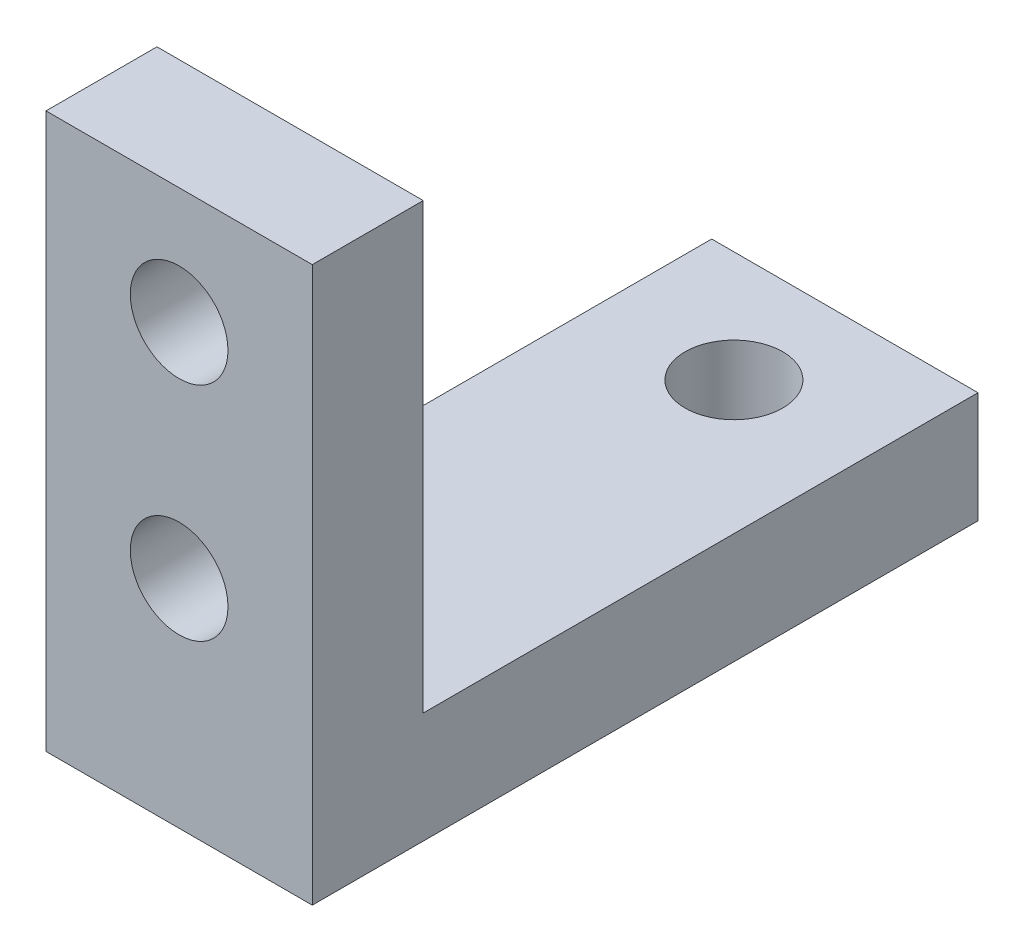
from build123d import *

# Parameters (mm, degrees)
SKETCH1_W           = 5
SKETCH1_H           = 20
SKETCH1_H_2         = 5
SKETCH1_W_2         = 25
BOSS_EXTRUDE1_DEPTH = 12
SKETCH2_R           = 2.2
CUT_EXTRUDE1_DEPTH  = 12
CUT_EXTRUDE3_DEPTH  = 5


with BuildPart() as part:
    # Sketch1 → Boss-Extrude1 (new body)
    with BuildSketch(Plane(origin=(0, 0, 0), x_dir=(0, 0, -1), z_dir=(1, 0, 0))):
        with Locations((2.5, 15)):
            Rectangle(SKETCH1_W, SKETCH1_H)
        with Locations((2.5, 2.5)):
            Rectangle(SKETCH1_W, SKETCH1_H_2)
        with Locations((17.5, 2.5)):
            Rectangle(SKETCH1_W_2, SKETCH1_H_2)
    extrude(amount=BOSS_EXTRUDE1_DEPTH)

    # Sketch2 → Cut-Extrude1 (cut)
    with BuildSketch(Plane(origin=(0, 0, -5), x_dir=(-1, 0, 0), z_dir=(0, 0, -1))):
        with Locations((-6, 19.75)):
            Circle(SKETCH2_R)
        with Locations((-6, 9.75)):
            Circle(SKETCH2_R)
    extrude(amount=-CUT_EXTRUDE1_DEPTH, mode=Mode.SUBTRACT)

    # Sketch3 → Cut-Extrude3 (cut)
    with BuildSketch(Plane.XZ):
        with BuildLine():
            ThreePointArc((8.2, -25), (7.555634919, -23.444365081), (6, -22.8))
            Line((6, -22.8), (6, -27.2))
            ThreePointArc((6, -27.2), (7.555634919, -26.555634919), (8.2, -25))
        make_face()
        with BuildLine():
            Line((6, -27.2), (6, -22.8))
            ThreePointArc((6, -22.8), (3.8, -25), (6, -27.2))
        make_face()
    extrude(amount=-CUT_EXTRUDE3_DEPTH, mode=Mode.SUBTRACT)


solid = part.part
